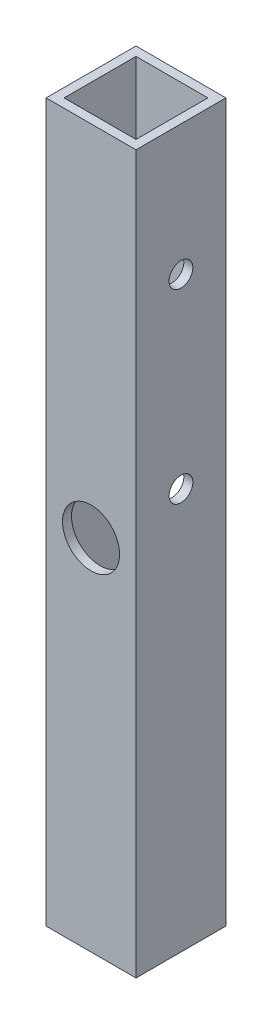
from build123d import *

# Parameters (mm, degrees)
SKETCH1_W               = 20
SKETCH1_H               = 159.6
BOSS_EXTRUDE1_DEPTH     = 2
BOSS_EXTRUDE2_DEPTH     = 159.6
CUT_EXTRUDE1_DEPTH      = 83.873638752
CUT_EXTRUDE1_DEPTH_BACK = 83.873638752
SKETCH3_R               = 6.35
CUT_EXTRUDE2_DEPTH      = 85.664278182
CUT_EXTRUDE2_DEPTH_BACK = 85.664278182
SKETCH5_R               = 2.65


with BuildPart() as part:
    # Sketch1 → Boss-Extrude1 (new body)
    with BuildSketch(Plane.XY):
        Rectangle(SKETCH1_W, SKETCH1_H)
    extrude(amount=BOSS_EXTRUDE1_DEPTH)

    # Sketch4 → Boss-Extrude2 (add)
    with BuildSketch(Plane(origin=(0, 79.8, 0), x_dir=(1, 0, 0), z_dir=(0, 1, 0))):
        Polygon((-8, -2), (-10, -2), (-10, -20), (10, -20), (10, -2), (8, -2), (8, -18), (-8, -18), align=None)
    extrude(amount=-BOSS_EXTRUDE2_DEPTH)

    # Sketch3 → Cut-Extrude1 (cut, two sides: drawn at the far end of the back side and taken through both)
    with BuildSketch(Plane(origin=(0, 0, 0), x_dir=(-1, 0, 0), z_dir=(0, 0, -1)).offset(-CUT_EXTRUDE1_DEPTH_BACK)):
        Circle(SKETCH3_R)
    extrude(amount=CUT_EXTRUDE1_DEPTH + CUT_EXTRUDE1_DEPTH_BACK, mode=Mode.SUBTRACT)

    # Sketch5 → Cut-Extrude2 (cut, two sides: drawn at the far end of the back side and taken through both)
    with BuildSketch(Plane(origin=(10, 0, 0), x_dir=(0, 0, -1), z_dir=(1, 0, 0)).offset(-CUT_EXTRUDE2_DEPTH_BACK)):
        with Locations(Location((-10, 50.8, 0), (0, 0, 180))):
            Circle(SKETCH5_R)
        with Locations(Location((-10, 9.434271247, 0), (0, 0, 180))):
            Circle(SKETCH5_R)
    extrude(amount=CUT_EXTRUDE2_DEPTH + CUT_EXTRUDE2_DEPTH_BACK, mode=Mode.SUBTRACT)


solid = part.part
